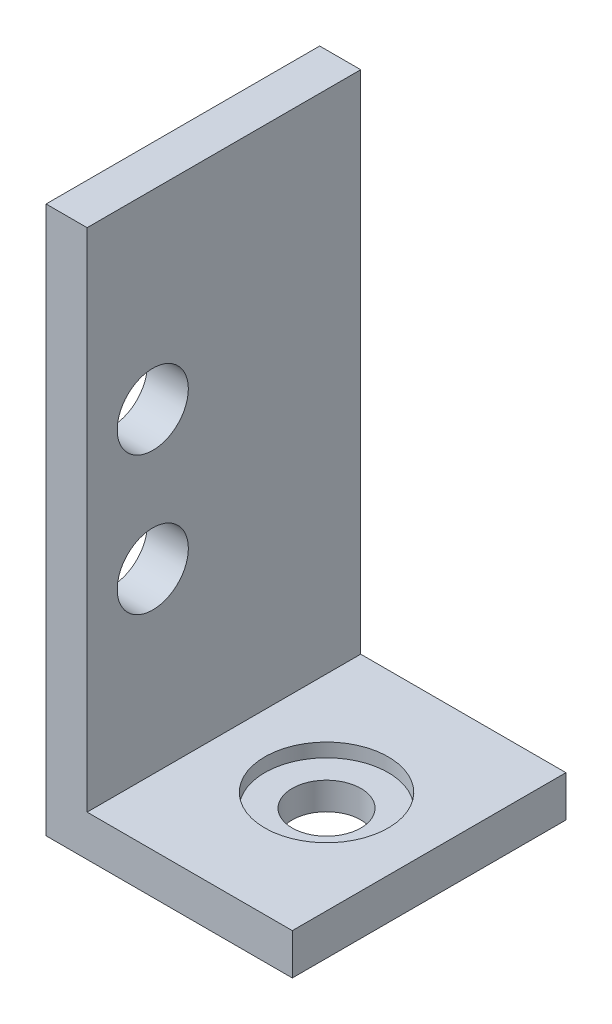
from build123d import *

# Parameters (mm, degrees)
SKETCH1_W                = 15
SKETCH1_H                = 20
SKETCH1_R                = 2.51
BOSS_EXTRUDE1_DEPTH      = 3
SKETCH2_R                = 4.51
CUT_EXTRUDE1_DEPTH       = 1
BOSS_EXTRUDE2_DEPTH      = 22
BOSS_EXTRUDE2_DEPTH_BACK = 3
SKETCH3_W                = 3
SKETCH3_H                = 20
SKETCH4_R                = 2.6
CUT_EXTRUDE2_DEPTH       = 22
BOSS_EXTRUDE3_START      = -3
SKETCH5_R                = 2.6
BOSS_EXTRUDE3_DEPTH      = 3
CUT_EXTRUDE3_DEPTH       = 5
SKETCH7_W                = 20
SKETCH7_H                = 20
BOSS_EXTRUDE4_DEPTH      = 3
SKETCH8_R                = 2.6
CUT_EXTRUDE6_DEPTH       = 3


with BuildPart() as part:
    # Sketch1 → Boss-Extrude1 (new body)
    with BuildSketch(Plane(origin=(0, 0, 0), x_dir=(1, 0, 0), z_dir=(0, 1, 0))):
        with Locations((23.125880705, 19.115097078)):
            Rectangle(SKETCH1_W, SKETCH1_H)
        with Locations((23.125880705, 19.115097078)):
            Circle(SKETCH1_R, mode=Mode.SUBTRACT)
    extrude(amount=BOSS_EXTRUDE1_DEPTH)

    # Sketch2 → Cut-Extrude1 (cut)
    with BuildSketch(Plane(origin=(0, 3, 0), x_dir=(1, 0, 0), z_dir=(0, 1, 0))):
        with Locations((23.125880705, 19.115097078)):
            Circle(SKETCH2_R)
    extrude(amount=-CUT_EXTRUDE1_DEPTH, mode=Mode.SUBTRACT)

    # Sketch3 → Boss-Extrude2 (add, two sides: drawn at the far end of the back side and taken through both)
    with BuildSketch(Plane(origin=(0, 3, 0), x_dir=(1, 0, 0), z_dir=(0, 1, 0)).offset(-BOSS_EXTRUDE2_DEPTH_BACK)):
        with Locations((14.125880705, 19.115097078)):
            Rectangle(SKETCH3_W, SKETCH3_H)
    extrude(amount=BOSS_EXTRUDE2_DEPTH + BOSS_EXTRUDE2_DEPTH_BACK)

    # Sketch4 → Cut-Extrude2 (cut)
    with BuildSketch(Plane.ZY.offset(-12.625880705)):
        with Locations((-23.115097078, 19)):
            Circle(SKETCH4_R)
        with Locations((-23.115097078, 6)):
            Circle(SKETCH4_R)
    extrude(amount=-CUT_EXTRUDE2_DEPTH, mode=Mode.SUBTRACT)

    # Sketch5 → Boss-Extrude3 (add)
    with BuildSketch(Plane(origin=(15.625880705, 0, 0), x_dir=(0, 0, -1), z_dir=(1, 0, 0)).offset(BOSS_EXTRUDE3_START)):
        with Locations((23.115097078, 19)):
            Circle(SKETCH5_R)
        with Locations((23.115097078, 6)):
            Circle(SKETCH5_R)
    extrude(amount=BOSS_EXTRUDE3_DEPTH)

    # Sketch6 → Cut-Extrude3 (cut)
    with BuildSketch(Plane(origin=(12.625880705, 25, -29.115097078), x_dir=(1, 0, 0), z_dir=(0, 1, 0))):
        Polygon((0, -14.855128206), (0, -20), (3, -20), (3, -14.855128206), (3, 0), (0, 0), align=None)
    extrude(amount=-CUT_EXTRUDE3_DEPTH, mode=Mode.SUBTRACT)

    # Sketch7 → Boss-Extrude4 (add)
    with BuildSketch(Plane.ZY.offset(-12.625880705)):
        with Locations((-19.115097078, 30)):
            Rectangle(SKETCH7_W, SKETCH7_H)
    extrude(amount=-BOSS_EXTRUDE4_DEPTH)

    # Sketch8 → Cut-Extrude6 (cut)
    with BuildSketch(Plane(origin=(15.625880705, 0, 0), x_dir=(0, 0, -1), z_dir=(1, 0, 0))):
        with Locations((13.915097078, 16)):
            Circle(SKETCH8_R)
        with Locations((13.915097078, 26.1)):
            Circle(SKETCH8_R)
    extrude(amount=-CUT_EXTRUDE6_DEPTH, mode=Mode.SUBTRACT)


solid = part.part
